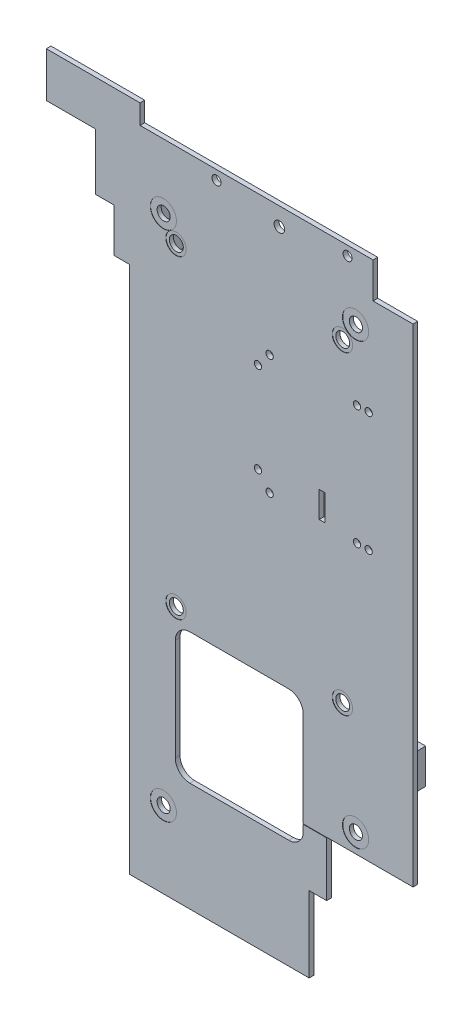
from build123d import *

# Parameters (mm, degrees)
EXTRUSION1_DEPTH         = 1.6
ESQUISSE3_R              = 2.4
ENL_V_MAT_EXTRU_2_DEPTH  = 3
ESQUISSE4_R              = 2.25
ENL_V_MAT_EXTRU_3_DEPTH  = 10
ENL_V_MAT_EXTRU_4_DEPTH  = 10
ESQUISSE6_R              = 1.55
ENL_V_MAT_EXTRU_5_DEPTH  = 2
ESQUISSE7_R              = 1.8
ENL_V_MAT_EXTRU_6_DEPTH  = 2
ESQUISSE8_W              = 3.6
ESQUISSE8_H              = 12
EXTRUSION2_DEPTH         = 4.5
ESQUISSE10_R             = 4.5
ENL_V_MAT_EXTRU_7_DEPTH  = 0.1
ESQUISSE19_W             = 10.8
ESQUISSE19_H             = 22.7
EXTRUSION12_DEPTH        = 13.2
ESQUISSE23_W             = 8.032982088
ESQUISSE23_H             = 0.2
ENL_V_MAT_EXTRU_10_DEPTH = 0.1
ESQUISSE26_R             = 3.5
ENL_V_MAT_EXTRU_11_DEPTH = 0.1
ENL_V_START              = -0.1
ESQUISSE27_R             = 3.5
ENL_V_MAT_EXTRU_12_DEPTH = 0.1
ESQUISSE30_R             = 0.8
EXTRUSION14_DEPTH        = 1
ESQUISSE32_W             = 13.032086964
ESQUISSE32_H             = 29.119345892
ENL_V_MAT_EXTRU_15_DEPTH = 10
ESQUISSE38_W             = 3.5
ESQUISSE38_H             = 9
EXTRUSION20_DEPTH        = 5
ESQUISSE40_R             = 1.25
ESQUISSE40_W             = 2
ESQUISSE40_H             = 8.965480912
ENL_V_MAT_EXTRU_16_DEPTH = 10
ENL_V_MAT_EXTRU_17_DEPTH = 10


with BuildPart() as part:
    # Esquisse1 → Extrusion1 (new body)
    with BuildSketch(Plane.XY):
        Polygon((45.902468776, -16.999888115), (45.902468776, -184.415394951), (16.22088018, -184.415394951), (16.22088018, -229.296420917), (-51.512423031, -229.296420917), (-51.512423031, -47.949999998), (-63.097644562, -47.949999998), (-63.097644562, -13.499999747), (-80.044329504, -13.499999747), (-80.044329504, 1.914815016), (-47.830041474, 1.914815016), (-47.830041474, -4.796422374), (32.16998758, -4.796422374), (32.16998758, -16.999888115), align=None)
    extrude(amount=EXTRUSION1_DEPTH)

    # Esquisse3 → Enlèv. mat.-Extru.2 (cut)
    with BuildSketch(Plane(origin=(0, 0, 0), x_dir=(-1, 0, 0), z_dir=(0, 0, -1))):
        with Locations((-21.656316362, -141.741425249)):
            Circle(ESQUISSE3_R)
        with Locations((35.493683638, -141.741425249)):
            Circle(ESQUISSE3_R)
        with Locations((-21.656316362, -33.791425249)):
            Circle(ESQUISSE3_R)
        with Locations((35.493683638, -33.791425249)):
            Circle(ESQUISSE3_R)
    extrude(amount=-ENL_V_MAT_EXTRU_2_DEPTH, mode=Mode.SUBTRACT)

    # Esquisse4 → Enlèv. mat.-Extru.3 (cut)
    with BuildSketch(Plane.XY.offset(1.6)):
        with Locations((26.170115332, -26.99975322)):
            Circle(ESQUISSE4_R)
        with Locations((-39.829884666, -27.000195468)):
            Circle(ESQUISSE4_R)
        with Locations((26.171127143, -177.999753216)):
            Circle(ESQUISSE4_R)
        with Locations((-39.828705337, -203.000195464)):
            Circle(ESQUISSE4_R)
    extrude(amount=-ENL_V_MAT_EXTRU_3_DEPTH, mode=Mode.SUBTRACT)

    # Esquisse5 → Enlèv. mat.-Extru.4 (cut)
    with BuildSketch(Plane(origin=(0, 0, 0), x_dir=(-1, 0, 0), z_dir=(0, 0, -1))):
        with BuildLine():
            Line((-8.188160733, -186.837695498), (-8.188160733, -151.837794325))
            ThreePointArc((-8.188160733, -151.837794325), (-6.723694639, -148.30226042), (-3.188160733, -146.837794325))
            Line((-3.188160733, -146.837794325), (30.738384276, -146.837794325))
            ThreePointArc((30.738384276, -146.837794325), (34.273918182, -148.30226042), (35.738384276, -151.837794325))
            Line((35.738384276, -151.837794325), (35.738384276, -186.837695498))
            ThreePointArc((35.738384276, -186.837695498), (34.273918182, -190.373229404), (30.738384276, -191.837695498))
            Line((30.738384276, -191.837695498), (-3.188160733, -191.837695498))
            ThreePointArc((-3.188160733, -191.837695498), (-6.723694639, -190.373229404), (-8.188160733, -186.837695498))
        make_face()
    extrude(amount=-ENL_V_MAT_EXTRU_4_DEPTH, mode=Mode.SUBTRACT)

    # Esquisse6 → Enlèv. mat.-Extru.5 (cut)
    with BuildSketch(Plane.XY.offset(1.6)):
        with Locations((23.399949199, -7.999901551)):
            Circle(ESQUISSE6_R)
        with Locations((-21.600050801, -7.999953529)):
            Circle(ESQUISSE6_R)
    extrude(amount=-ENL_V_MAT_EXTRU_5_DEPTH, mode=Mode.SUBTRACT)

    # Esquisse7 → Enlèv. mat.-Extru.6 (cut)
    with BuildSketch(Plane.XY.offset(1.6)):
        with Locations((-5.456e-06, -10.999928579)):
            Circle(ESQUISSE7_R)
    extrude(amount=-ENL_V_MAT_EXTRU_6_DEPTH, mode=Mode.SUBTRACT)

    # Esquisse8 → Extrusion2 (add)
    with BuildSketch(Plane(origin=(0, 0, 0), x_dir=(-1, 0, 0), z_dir=(0, 0, -1))):
        with Locations((-42.352506676, -152.415391345)):
            Rectangle(ESQUISSE8_W, ESQUISSE8_H)
    extrude(amount=EXTRUSION2_DEPTH)

    # Esquisse10 → Enlèv. mat.-Extru.7 (cut)
    with BuildSketch(Plane.XY.offset(1.6)):
        with Locations((26.169971141, -26.999898346)):
            Circle(ESQUISSE10_R)
        with Locations((-39.830028858, -26.999974585)):
            Circle(ESQUISSE10_R)
        with Locations((26.170145567, -177.999898346)):
            Circle(ESQUISSE10_R)
        with Locations((-39.829825555, -202.999974585)):
            Circle(ESQUISSE10_R)
    extrude(amount=-ENL_V_MAT_EXTRU_7_DEPTH, mode=Mode.SUBTRACT)

    # Esquisse19 → Extrusion12 (add)
    with BuildSketch(Plane(origin=(0, 0, 0), x_dir=(-1, 0, 0), z_dir=(0, 0, -1))):
        with Locations((50.547644562, -34.684676228)):
            Rectangle(ESQUISSE19_W, ESQUISSE19_H)
    extrude(amount=EXTRUSION12_DEPTH)

    # Esquisse23 → Enlèv. mat.-Extru.10 (cut)
    with BuildSketch(Plane.XY.offset(1.6)):
        with Locations((12.204651777, -184.515396319)):
            Rectangle(ESQUISSE23_W, ESQUISSE23_H)
    extrude(amount=-ENL_V_MAT_EXTRU_10_DEPTH, mode=Mode.SUBTRACT)

    # Esquisse26 → Enlèv. mat.-Extru.11 (cut)
    with BuildSketch(Plane(origin=(0, 0, 0), x_dir=(-1, 0, 0), z_dir=(0, 0, -1))):
        with Locations((-26.171127143, -177.999753216)):
            Circle(ESQUISSE26_R)
        with Locations((-21.656316362, -141.741425249)):
            Circle(ESQUISSE26_R)
        with Locations((35.493683638, -141.741425249)):
            Circle(ESQUISSE26_R)
        with Locations((-26.170115332, -26.99975322)):
            Circle(ESQUISSE26_R)
        with Locations((-21.656316362, -33.791425249)):
            Circle(ESQUISSE26_R)
        with Locations((35.493683638, -33.791425249)):
            Circle(ESQUISSE26_R)
        with Locations((39.829884666, -27.000195468)):
            Circle(ESQUISSE26_R)
    extrude(amount=-ENL_V_MAT_EXTRU_11_DEPTH, mode=Mode.SUBTRACT)

    # Esquisse27 → Enlèv. mat.-Extru.12 (cut)
    with BuildSketch(Plane.XY.offset(1.6).offset(ENL_V_START)):
        with Locations((-35.493683638, -33.791425249)):
            Circle(ESQUISSE27_R)
        with Locations((21.656316362, -33.791425249)):
            Circle(ESQUISSE27_R)
        with Locations((-35.493683638, -141.741425249)):
            Circle(ESQUISSE27_R)
        with Locations((21.656316362, -141.741425249)):
            Circle(ESQUISSE27_R)
    extrude(amount=ENL_V_MAT_EXTRU_12_DEPTH, mode=Mode.SUBTRACT)

    # Esquisse30 → Extrusion14 (add)
    with BuildSketch(Plane(origin=(0, 0, 0), x_dir=(-1, 0, 0), z_dir=(0, 0, -1))):
        with Locations((-41.152518707, -181.415394951)):
            Circle(ESQUISSE30_R)
    extrude(amount=EXTRUSION14_DEPTH)

    # Esquisse32 → Enlèv. mat.-Extru.15 (cut)
    with BuildSketch(Plane(origin=(0, 0, 0), x_dir=(-1, 0, 0), z_dir=(0, 0, -1))):
        with Locations((-16.736923724, -217.856098053)):
            Rectangle(ESQUISSE32_W, ESQUISSE32_H)
    extrude(amount=-ENL_V_MAT_EXTRU_15_DEPTH, mode=Mode.SUBTRACT)

    # Esquisse38 → Extrusion20 (add)
    with BuildSketch(Plane(origin=(0, 0, 0), x_dir=(-1, 0, 0), z_dir=(0, 0, -1))):
        with Locations((48.080624066, -77.449999998)):
            Rectangle(ESQUISSE38_W, ESQUISSE38_H)
    extrude(amount=EXTRUSION20_DEPTH)

    # Esquisse40 → Enlèv. mat.-Extru.16 (cut)
    with BuildSketch(Plane(origin=(0, 0, 0), x_dir=(-1, 0, 0), z_dir=(0, 0, -1))):
        with Locations((-30.652432705, -50.799882548)):
            Circle(ESQUISSE40_R)
        with Locations((-26.652432705, -50.799882548)):
            Circle(ESQUISSE40_R)
        with Locations((3.347567295, -50.799882548)):
            Circle(ESQUISSE40_R)
        with Locations((7.347567295, -55.799882548)):
            Circle(ESQUISSE40_R)
        with Locations((-30.652432705, -91.799882548)):
            Circle(ESQUISSE40_R)
        with Locations((-26.652432705, -91.799882548)):
            Circle(ESQUISSE40_R)
        with Locations((3.347567295, -91.799882548)):
            Circle(ESQUISSE40_R)
        with Locations((7.347567295, -86.799882548)):
            Circle(ESQUISSE40_R)
        with Locations((-14.652432705, -86.751416152)):
            Rectangle(ESQUISSE40_W, ESQUISSE40_H)
    extrude(amount=-ENL_V_MAT_EXTRU_16_DEPTH, mode=Mode.SUBTRACT)

    # Esquisse43 → Enlèv. mat.-Extru.17 (cut)
    with BuildSketch(Plane(origin=(0, 0, 0), x_dir=(-1, 0, 0), z_dir=(0, 0, -1))):
        Polygon((56.847644247, -52.137617645), (56.847644247, -32.949999998), (73.023827772, -32.949999998), (73.023826653, -52.137618589), align=None)
    extrude(amount=-ENL_V_MAT_EXTRU_17_DEPTH, mode=Mode.SUBTRACT)


solid = part.part
